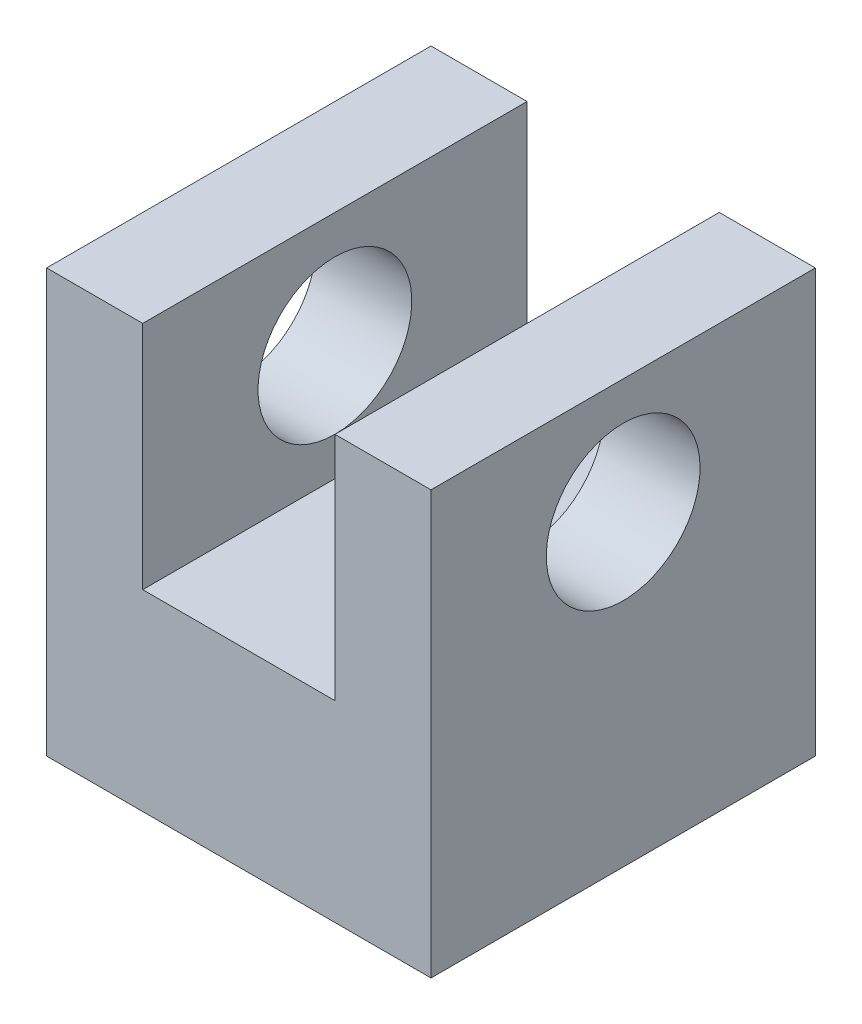
from build123d import *

# Parameters (mm, degrees)
BOSS_EXTRU_1_DEPTH           = 20
ENL_V_MAT_EXTRU_1_DEPTH      = 34.301651611
ENL_V_MAT_EXTRU_1_DEPTH_BACK = 34.301651611
ESQUISSE2_R                  = 4


with BuildPart() as part:
    # Esquisse1 → Boss.-Extru.1 (new body)
    with BuildSketch(Plane.XY):
        Polygon((-10, 0), (10, 0), (10, 22), (5, 22), (5, 10), (-5, 10), (-5, 22), (-10, 22), align=None)
    extrude(amount=BOSS_EXTRU_1_DEPTH)

    # Esquisse2 → Enlèv. mat.-Extru.1 (cut, two sides: drawn at the far end of the back side and taken through both)
    with BuildSketch(Plane(origin=(-5, 0, 0), x_dir=(0, 0, -1), z_dir=(1, 0, 0)).offset(-ENL_V_MAT_EXTRU_1_DEPTH_BACK)):
        with Locations(Location((-10, 16, 0), (0, 0, 90))):
            Circle(ESQUISSE2_R)
    extrude(amount=ENL_V_MAT_EXTRU_1_DEPTH + ENL_V_MAT_EXTRU_1_DEPTH_BACK, mode=Mode.SUBTRACT)


solid = part.part
